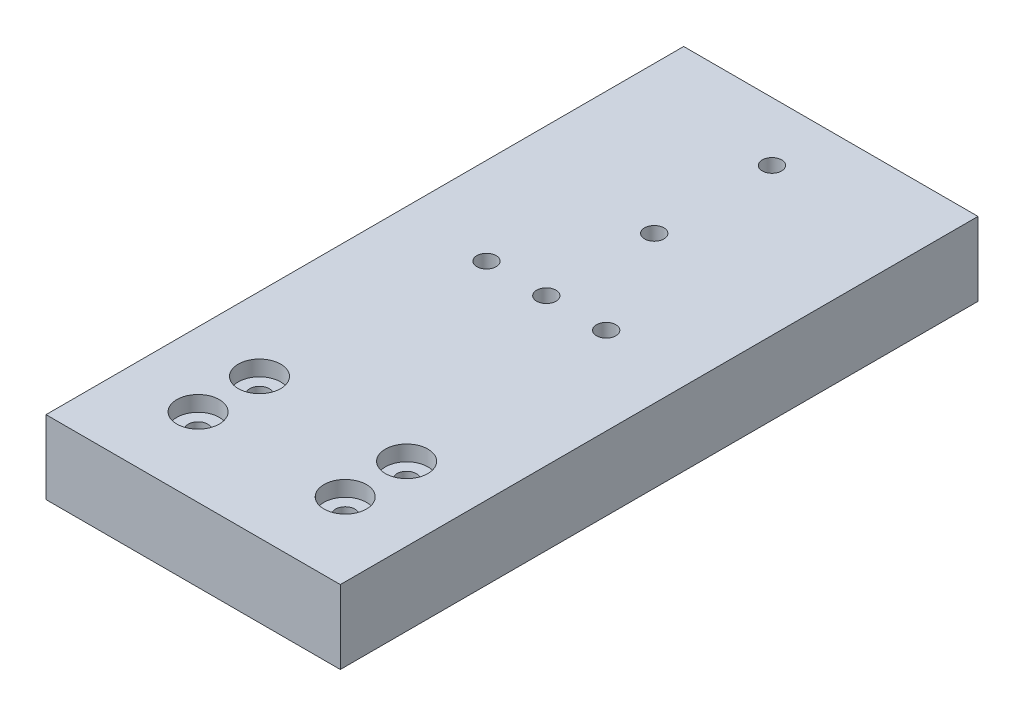
from build123d import *

# Parameters (mm, degrees)
SKETCH1_W           = 38.1
SKETCH1_H           = 82.55
BOSS_EXTRUDE1_DEPTH = 9.525
SKETCH2_R           = 2.77495
CUT_EXTRUDE1_DEPTH  = 1.99898
SKETCH3_R           = 1.25
CUT_EXTRUDE2_DEPTH  = 92.41574331
SKETCH4_R           = 2.74955
SKETCH4_R_2         = 2.77495
CUT_EXTRUDE3_DEPTH  = 1.99898
SKETCH5_R           = 1.25
CUT_EXTRUDE4_DEPTH  = 92.41574331
SKETCH6_R           = 2.75
CUT_EXTRUDE5_DEPTH  = 1.99898
SKETCH7_R           = 1.25
CUT_EXTRUDE6_DEPTH  = 10


with BuildPart() as part:
    # Sketch1 → Boss-Extrude1 (new body)
    with BuildSketch(Plane(origin=(0, 0, 0), x_dir=(1, 0, 0), z_dir=(0, 1, 0))):
        with Locations((19.05, 41.275)):
            Rectangle(SKETCH1_W, SKETCH1_H)
    extrude(amount=BOSS_EXTRUDE1_DEPTH)

    # Sketch2 → Cut-Extrude1 (cut)
    with BuildSketch(Plane.XZ):
        with Locations(Location((19.05, -74.93, 0), (0, 0, 270))):
            Circle(SKETCH2_R)
        with Locations(Location((19.05, -59.69, 0), (0, 0, 270))):
            Circle(SKETCH2_R)
    extrude(amount=-CUT_EXTRUDE1_DEPTH, mode=Mode.SUBTRACT)

    # Sketch3 → Cut-Extrude2 (cut, through all)
    with BuildSketch(Plane.XZ):
        with Locations(Location((19.05, -74.93, 0), (0, 0, 270))):
            Circle(SKETCH3_R)
        with Locations(Location((19.05, -59.69, 0), (0, 0, 270))):
            Circle(SKETCH3_R)
    extrude(amount=-CUT_EXTRUDE2_DEPTH, mode=Mode.SUBTRACT)

    # Sketch4 → Cut-Extrude3 (cut)
    with BuildSketch(Plane.XZ):
        with Locations(Location((19.05, -45.72, 0), (0, 0, 270))):
            Circle(SKETCH4_R)
        with Locations(Location((11.30403505, -45.72, 0), (0, 0, 270))):
            Circle(SKETCH4_R_2)
        with Locations(Location((26.79596495, -45.72, 0), (0, 0, 270))):
            Circle(SKETCH4_R_2)
    extrude(amount=-CUT_EXTRUDE3_DEPTH, mode=Mode.SUBTRACT)

    # Sketch5 → Cut-Extrude4 (cut, through all)
    with BuildSketch(Plane.XZ):
        with Locations(Location((19.05, -45.72, 0), (0, 0, 270))):
            Circle(SKETCH5_R)
        with Locations(Location((26.79596495, -45.72, 0), (0, 0, 270))):
            Circle(SKETCH5_R)
        with Locations(Location((11.30403505, -45.72, 0), (0, 0, 270))):
            Circle(SKETCH5_R)
    extrude(amount=-CUT_EXTRUDE4_DEPTH, mode=Mode.SUBTRACT)

    # Sketch6 → Cut-Extrude5 (cut)
    with BuildSketch(Plane(origin=(0, 9.525, 0), x_dir=(1, 0, 0), z_dir=(0, 1, 0))):
        with Locations(Location((9.525, 18.1102, 0), (0, 0, 270))):
            Circle(SKETCH6_R)
        with Locations(Location((9.525, 10.16, 0), (0, 0, 270))):
            Circle(SKETCH6_R)
        with Locations(Location((28.575, 18.1102, 0), (0, 0, 270))):
            Circle(SKETCH6_R)
        with Locations(Location((28.575, 10.16, 0), (0, 0, 270))):
            Circle(SKETCH6_R)
    extrude(amount=-CUT_EXTRUDE5_DEPTH, mode=Mode.SUBTRACT)

    # Sketch7 → Cut-Extrude6 (cut)
    with BuildSketch(Plane(origin=(0, 9.525, 0), x_dir=(1, 0, 0), z_dir=(0, 1, 0))):
        with Locations(Location((9.525, 18.1102, 0), (0, 0, 270))):
            Circle(SKETCH7_R)
        with Locations(Location((9.525, 10.16, 0), (0, 0, 270))):
            Circle(SKETCH7_R)
        with Locations(Location((28.575, 10.16, 0), (0, 0, 270))):
            Circle(SKETCH7_R)
        with Locations(Location((28.575, 18.1102, 0), (0, 0, 270))):
            Circle(SKETCH7_R)
    extrude(amount=-CUT_EXTRUDE6_DEPTH, mode=Mode.SUBTRACT)


solid = part.part
